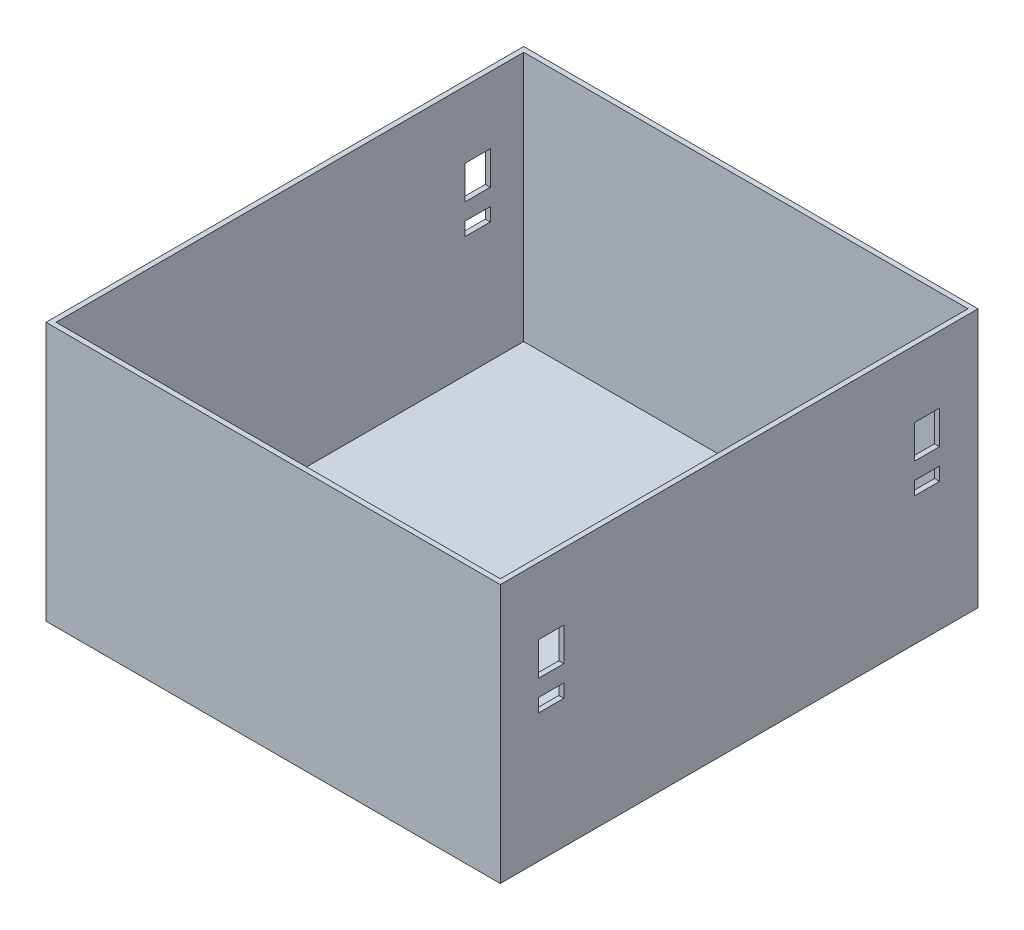
from build123d import *

# Parameters (mm, degrees)
SKETCH_1_W          = 272
SKETCH_1_H          = 286
SKETCH_1_W_2        = 266
SKETCH_1_H_2        = 280
EXTRUDE_1_DEPTH     = 150
SKETCH_2_W          = 272
SKETCH_2_H          = 286
EXTRUDE_2_DEPTH     = 5
SKETCH_3_W          = 15
SKETCH_3_H          = 8
SKETCH_3_H_2        = 20
CUT_EXTRUDE_1_DEPTH = 342.954675359


with BuildPart() as part:
    # 草圖1 → 填料-伸長1 (new body)
    with BuildSketch(Plane(origin=(0, 0, 0), x_dir=(1, 0, 0), z_dir=(0, 1, 0))):
        Rectangle(SKETCH_1_W, SKETCH_1_H)
        Rectangle(SKETCH_1_W_2, SKETCH_1_H_2, mode=Mode.SUBTRACT)
    extrude(amount=EXTRUDE_1_DEPTH)

    # 草圖2 → 填料-伸長2 (add)
    with BuildSketch(Plane.XZ):
        Rectangle(SKETCH_2_W, SKETCH_2_H)
    extrude(amount=EXTRUDE_2_DEPTH)

    # 草圖3 → 除料-伸長1 (cut, through all)
    with BuildSketch(Plane.ZY.offset(136)):
        with Locations((-112.5, 76)):
            Rectangle(SKETCH_3_W, SKETCH_3_H)
        with Locations((-112.5, 100)):
            Rectangle(SKETCH_3_W, SKETCH_3_H_2)
    cut_extrude_1 = extrude(amount=-CUT_EXTRUDE_1_DEPTH, mode=Mode.SUBTRACT)

    # 鏡射1: 除料-伸長1 across plane
    add(cut_extrude_1.mirror(Plane.XY), mode=Mode.SUBTRACT)


solid = part.part
